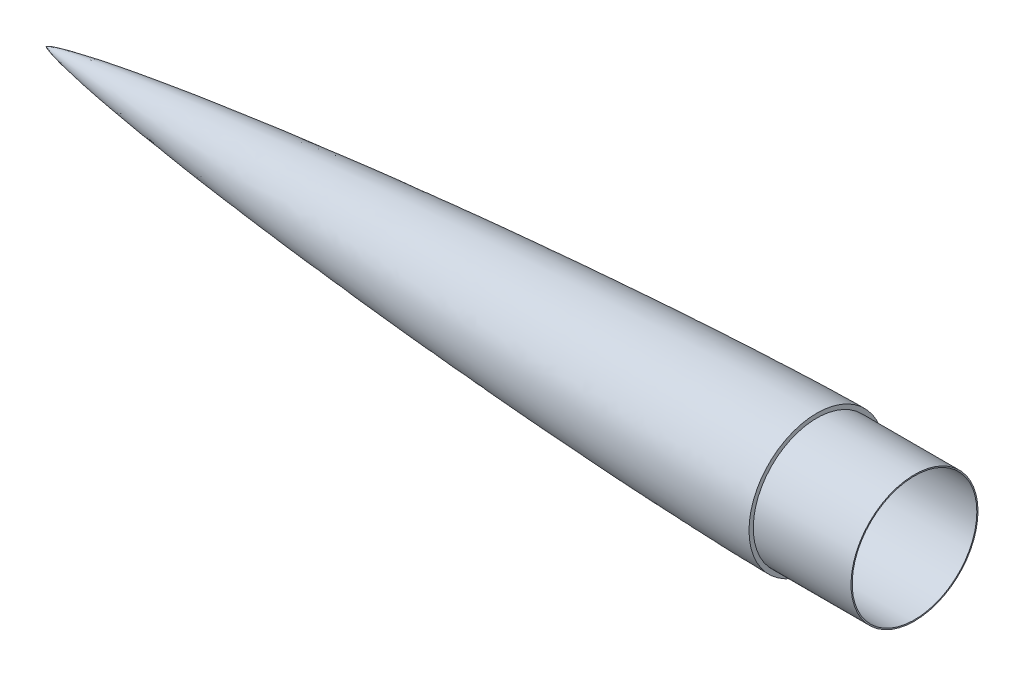
from build123d import *

# Parameters (mm, degrees)
SKETCH7_R           = 37.15
BOSS_EXTRUDE1_DEPTH = 57.2
SKETCH10_R          = 36.465
CUT_EXTRUDE1_DEPTH  = 57.2


with BuildPart() as part:
    # Sketch4 → Revolve1 (revolve)
    with BuildSketch(Plane.XY):
        with BuildLine():
            Line((451, 39.65), (451, 0))
            Line((451, 0), (0.000701246, 0))
            add(Edge.make_bspline(
                [(0.000701246, 0), (0.002506302, 0.004250308), (0.00680812, 0.012312245), (0.018396223, 0.026567262), (0.044870426, 0.051987464), (0.084367289, 0.083263169), (0.137290098, 0.119470755), (0.212480734, 0.165700096), (0.302732494, 0.215977448), (0.408604965, 0.270245958), (0.530135293, 0.328212169), (0.705937544, 0.407366655), (0.978806956, 0.521481954), (1.447715348, 0.70081044), (2.290942601, 0.990255514), (3.803522224, 1.450385156), (6.592175117, 2.192565449), (11.803862458, 3.39234852), (20.997899725, 5.207453532), (36.304145868, 7.801992547), (57.101225143, 10.838109762), (82.142689037, 14.064606), (109.694474906, 17.250908512), (137.276216784, 20.164082652), (164.880967367, 22.849887266), (192.504223184, 25.337299208), (220.143173378, 27.643621725), (247.795785791, 29.779575236), (275.460677162, 31.750129242), (303.136821137, 33.555775426), (330.823513329, 35.192009963), (358.520267123, 36.648600608), (382.763491855, 37.749324719), (403.549463902, 38.547560188), (420.308211797, 39.076417022), (431.587662282, 39.365684368), (440.851982053, 39.547180034), (446.650695, 39.622701869), (449.55020557, 39.646815638), (451, 39.65)],
                knots=[0, 0, 0, 0, 0, 4.0378e-05, 8.0757e-05, 0.000161513, 0.000323027, 0.00048454, 0.000646053, 0.000940145, 0.001234238, 0.001534067, 0.001833897, 0.002641117, 0.003843417, 0.005962695, 0.009698215, 0.016587688, 0.029299296, 0.053140175, 0.092371284, 0.153547186, 0.214723093, 0.275899002, 0.33707491, 0.398250818, 0.459426727, 0.520602636, 0.581778544, 0.642954453, 0.704130361, 0.765306269, 0.826482178, 0.887658087, 0.918246041, 0.948833995, 0.974416997, 0.987208499, 1, 1, 1, 1, 1], degree=4))
        make_face()
    revolve(axis=Axis((0.000701246, 0, 0), (1, 0, 0)))

    # Sketch7 → Boss-Extrude1 (add)
    with BuildSketch(Plane(origin=(451, 0, 0), x_dir=(0, 0, -1), z_dir=(1, 0, 0))):
        with Locations(Location((0, 0, 0), (0, 0, 270))):
            Circle(SKETCH7_R)
    extrude(amount=BOSS_EXTRUDE1_DEPTH)

    # Sketch10 → Cut-Extrude1 (cut)
    with BuildSketch(Plane(origin=(508.2, 0, 0), x_dir=(0, 0, -1), z_dir=(1, 0, 0))):
        Circle(SKETCH10_R)
    extrude(amount=-CUT_EXTRUDE1_DEPTH, mode=Mode.SUBTRACT)


solid = part.part
